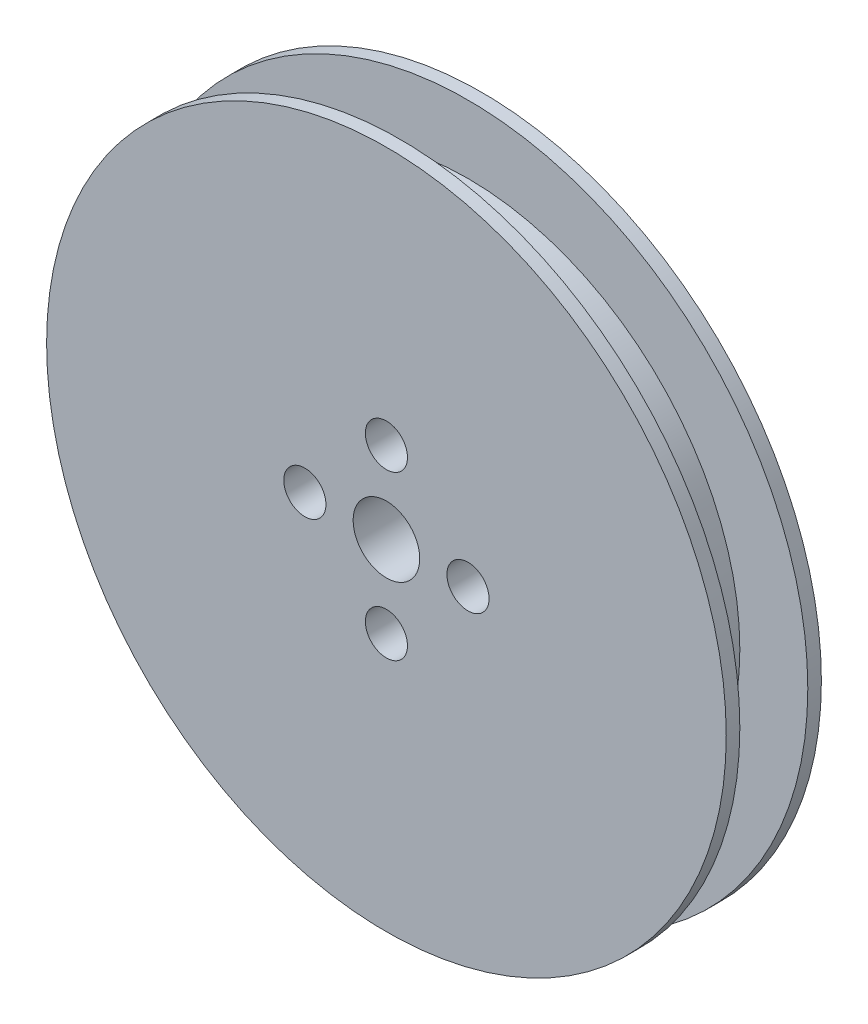
from build123d import *

# Parameters (mm, degrees)
SKETCH4_R          = 1.55
SKETCH4_R_2        = 2.45
CUT_EXTRUDE1_DEPTH = 37.041642582


with BuildPart() as part:
    # Sketch3 → Revolve2 (revolve)
    with BuildSketch(Plane(origin=(0, 0, 0), x_dir=(1, 0, 0), z_dir=(0, 1, 0)), mode=Mode.PRIVATE) as revolve2_sk:
        Polygon((0, 0), (-25, 0), (-25, -1), (-20, -1), (-20, -6), (-25, -6), (-25, -7), (0, -7), align=None)
    revolve(revolve2_sk.sketch.rotate(Axis((0, 0, 7), (0, 0, -1)), 180), axis=Axis((0, 0, 7), (0, 0, -1)))

    # Sketch4 → Cut-Extrude1 (cut, through all)
    with BuildSketch(Plane(origin=(0, 0, 0), x_dir=(-1, 0, 0), z_dir=(0, 0, -1))):
        with Locations((0, 6)):
            Circle(SKETCH4_R)
        with Locations((6, 0)):
            Circle(SKETCH4_R)
        with Locations((0, -6)):
            Circle(SKETCH4_R)
        with Locations((-6, 0)):
            Circle(SKETCH4_R)
        Circle(SKETCH4_R_2)
    extrude(amount=-CUT_EXTRUDE1_DEPTH, mode=Mode.SUBTRACT)


solid = part.part
